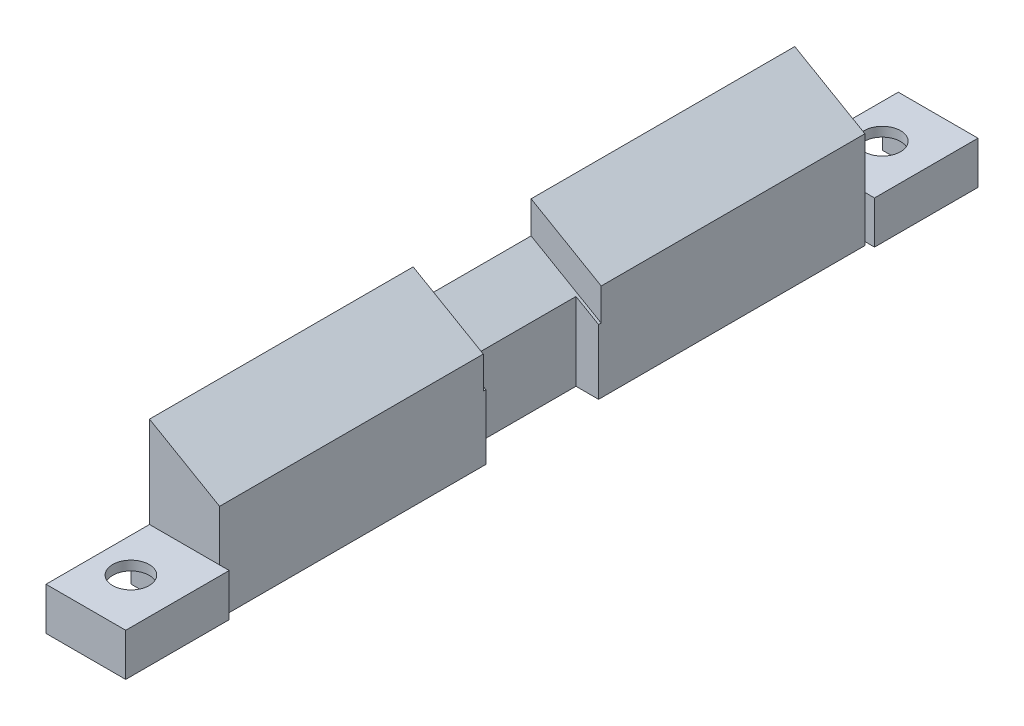
from build123d import *

# Parameters (mm, degrees)
CLAMP_START                      = -20.15
CLAMP_X_COVER_DEPTH              = 37.1
WIRE_START                       = -4.99
WIRE_CHANNEL_X_COVER_Z_5_0_DEPTH = 6.78
WIRE_START_2                     = -4.84
SKETCH3_W                        = 1.6
SKETCH3_H                        = 5.420657937
WIRE_NOTCH_X_COVER_Z_5_0_DEPTH   = 6.48
EAR_START                        = -26.1
SKETCH4_W                        = 4.582851153
SKETCH4_H                        = 2.45
EAR_X_COVER_26_DEPTH             = 5.95
EAR_START_2                      = 16.95
SKETCH5_W                        = 4.582851153
SKETCH5_H                        = 2.45
EAR_X_COVER_17_DEPTH             = 5.95
CUT_EXTRUDE3_START               = 18.7
SKETCH6_R                        = 1.05
CUT_EXTRUDE3_DEPTH               = 2.65
CUT_EXTRUDE4_START               = 18.79
SKETCH7_R                        = 2
CUT_EXTRUDE4_DEPTH               = 1.92
CUT_EXTRUDE5_START               = 18.79
SKETCH8_W                        = 2.082851153
SKETCH8_H                        = 4
CUT_EXTRUDE5_DEPTH               = 1.92
CUT_EXTRUDE6_START               = 18.79
CUT_EXTRUDE6_DEPTH               = 1.92
CUT_EXTRUDE7_START               = 18.79
CUT_EXTRUDE7_DEPTH               = 1.92


with BuildPart() as part:
    # Sketch1 → Clamp +X cover (new body)
    with BuildSketch(Plane.XY.offset(CLAMP_START)):
        Polygon((13.367148847, 18.6), (17.397275866, 18.6), (17.397275866, 24.170102587), (13.367148847, 26.496897507), align=None)
    extrude(amount=CLAMP_X_COVER_DEPTH)

    # Sketch2 → Wire channel +X cover Z -5.0 (cut)
    with BuildSketch(Plane.XY.offset(WIRE_START)):
        Polygon((11.102085338, 27.920102587), (19.762339376, 22.920102587), (18.912339376, 21.447859401), (10.252085338, 26.447859401), align=None)
    extrude(amount=WIRE_CHANNEL_X_COVER_Z_5_0_DEPTH, mode=Mode.SUBTRACT)

    # Sketch3 → Wire notch +X cover Z -5.0 (cut)
    with BuildSketch(Plane.XY.offset(WIRE_START_2)):
        with Locations((16.897275866, 21.210328969)):
            Rectangle(SKETCH3_W, SKETCH3_H)
    extrude(amount=WIRE_NOTCH_X_COVER_Z_5_0_DEPTH, mode=Mode.SUBTRACT)

    # Sketch4 → Ear +X cover -26 (add)
    with BuildSketch(Plane.XY.offset(EAR_START)):
        with Locations((15.658574424, 20.025)):
            Rectangle(SKETCH4_W, SKETCH4_H)
    extrude(amount=EAR_X_COVER_26_DEPTH)

    # Sketch5 → Ear +X cover 17 (add)
    with BuildSketch(Plane.XY.offset(EAR_START_2)):
        with Locations((15.658574424, 20.025)):
            Rectangle(SKETCH5_W, SKETCH5_H)
    extrude(amount=EAR_X_COVER_17_DEPTH)

    # Sketch6 → Cut-Extrude3 (cut)
    with BuildSketch(Plane(origin=(0, 0, 0), x_dir=(1, 0, 0), z_dir=(0, 1, 0)).offset(CUT_EXTRUDE3_START)):
        with Locations(Location((15.35, 23.2, 0), (0, 0, 90))):
            Circle(SKETCH6_R)
        with Locations(Location((15.35, -20, 0), (0, 0, 90))):
            Circle(SKETCH6_R)
    extrude(amount=CUT_EXTRUDE3_DEPTH, mode=Mode.SUBTRACT)

    # Sketch7 → Cut-Extrude4 (cut)
    with BuildSketch(Plane(origin=(0, 0, 0), x_dir=(1, 0, 0), z_dir=(0, 1, 0)).offset(CUT_EXTRUDE4_START)):
        with Locations((15.35, 23.2)):
            Circle(SKETCH7_R)
        with Locations((15.35, -20)):
            Circle(SKETCH7_R)
    extrude(amount=CUT_EXTRUDE4_DEPTH, mode=Mode.SUBTRACT)

    # Sketch8 → Cut-Extrude5 (cut)
    with BuildSketch(Plane(origin=(0, 0, 0), x_dir=(1, 0, 0), z_dir=(0, 1, 0)).offset(CUT_EXTRUDE5_START)):
        with Locations((14.308574424, 23.2)):
            Rectangle(SKETCH8_W, SKETCH8_H)
        with Locations((14.308574424, -20)):
            Rectangle(SKETCH8_W, SKETCH8_H)
    extrude(amount=CUT_EXTRUDE5_DEPTH, mode=Mode.SUBTRACT)

    # Sketch9 → Cut-Extrude6 (cut)
    with BuildSketch(Plane(origin=(0, 0, 0), x_dir=(1, 0, 0), z_dir=(0, 1, 0)).offset(CUT_EXTRUDE6_START)):
        Polygon((15.35, 25.2), (16.764213562, 24.614213562), (17.35, 24.028427125), (17.35, 22.371572875), (16.764213562, 21.785786438), (15.35, 21.2), align=None)
    extrude(amount=CUT_EXTRUDE6_DEPTH, mode=Mode.SUBTRACT)

    # Sketch10 → Cut-Extrude7 (cut)
    with BuildSketch(Plane(origin=(0, 0, 0), x_dir=(1, 0, 0), z_dir=(0, 1, 0)).offset(CUT_EXTRUDE7_START)):
        Polygon((15.35, -18), (16.764213562, -18.585786438), (17.35, -19.171572875), (17.35, -20.828427125), (16.764213562, -21.414213562), (15.35, -22), align=None)
    extrude(amount=CUT_EXTRUDE7_DEPTH, mode=Mode.SUBTRACT)


solid = part.part
